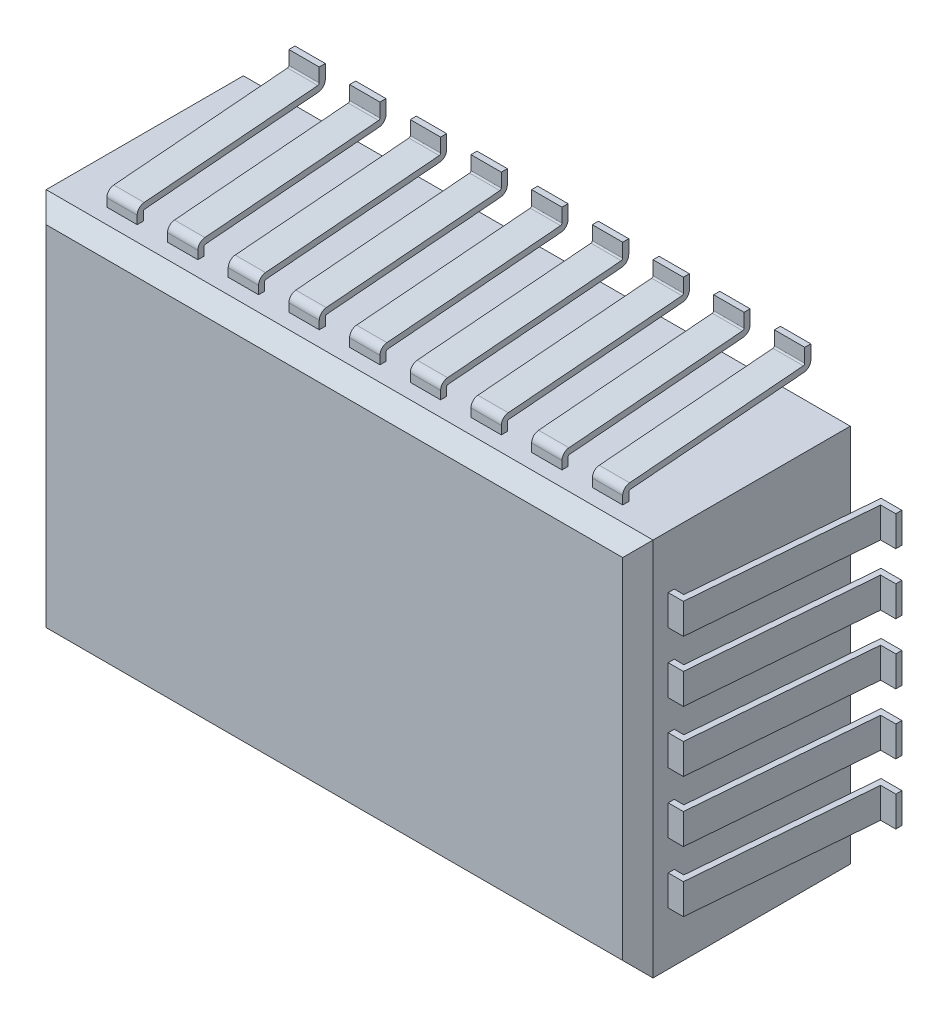
from build123d import *

# Parameters (mm, degrees)
COMPONENT_OUTLINE_W  = 4
COMPONENT_OUTLINE_H  = 2.5
EXTRUDE1_DEPTH       = 1.4
EXTRUDE_THIN1_DEPTH  = 0.1
LPATTERN1_COUNT      = 5
LPATTERN1_PITCH      = 0.4
LPATTERN1_COL_COUNT  = 5
LPATTERN1_COL_PITCH  = 0.4
MIRROR1_COPY_1_DEPTH = 0.1
MIRROR1_COPY_2_DEPTH = 0.1
MIRROR1_COPY_3_DEPTH = 0.1
MIRROR1_COPY_4_DEPTH = 0.1
MIRROR1_COPY_5_DEPTH = 0.1
MIRROR1_COPY_6_DEPTH = 0.1
MIRROR1_COPY_7_DEPTH = 0.1
MIRROR1_COPY_8_DEPTH = 0.1
EXTRUDE_THIN2_DEPTH  = 0.1
LPATTERN2_COUNT      = 3
LPATTERN2_PITCH      = 0.4
LPATTERN2_COL_COUNT  = 3
LPATTERN2_COL_PITCH  = 0.4
MIRROR2_COPY_1_DEPTH = 0.1
MIRROR2_COPY_2_DEPTH = 0.1
MIRROR2_COPY_3_DEPTH = 0.1
MIRROR2_COPY_4_DEPTH = 0.1
CHAMFER1_SIZE        = 0.1


with BuildPart() as part:
    # COMPONENT_OUTLINE → Extrude1 (new body)
    with BuildSketch(Plane.XY):
        Rectangle(COMPONENT_OUTLINE_W, COMPONENT_OUTLINE_H)
    extrude(amount=EXTRUDE1_DEPTH)

    # Sketch1 → Extrude-Thin1 (add, symmetric)
    with BuildSketch(Plane(origin=(0, 0, 0), x_dir=(0, 0, -1), z_dir=(1, 0, 0))):
        with BuildLine():
            Line((-1.2, 1.25), (-1.2, 1.303993356))
            ThreePointArc((-1.2, 1.303993356), (-1.186794114, 1.33784883), (-1.154152274, 1.353820644))
            Line((-1.154152274, 1.353820644), (-0.009169545, 1.449235871))
            ThreePointArc((-0.009169545, 1.449235871), (-0.002641177, 1.452430234), (0, 1.459201329))
            Line((0, 1.459201329), (0, 1.55))
            Line((0, 1.55), (0.04, 1.55))
            Line((0.04, 1.55), (0.04, 1.459201329))
            ThreePointArc((0.04, 1.459201329), (0.026794114, 1.425345854), (-0.005847726, 1.409374041))
            Line((-0.005847726, 1.409374041), (-1.150830455, 1.313958814))
            ThreePointArc((-1.150830455, 1.313958814), (-1.157358823, 1.310764451), (-1.16, 1.303993356))
            Line((-1.16, 1.303993356), (-1.16, 1.25))
            Line((-1.16, 1.25), (-1.2, 1.25))
        make_face()
    extrude_thin1 = extrude(amount=EXTRUDE_THIN1_DEPTH, both=True)

    # LPattern1: Extrude-Thin1 ×5
    with Locations(*[(-i * LPATTERN1_PITCH, 0, 0) for i in range(1, LPATTERN1_COUNT)]):
        add(extrude_thin1)

    # LPattern1 col: Extrude-Thin1 ×5
    with Locations(*[(i * LPATTERN1_COL_PITCH, 0, 0) for i in range(1, LPATTERN1_COL_COUNT)]):
        add(extrude_thin1)

    # Mirror1: Extrude-Thin1 across plane
    add(extrude_thin1.mirror(Plane.ZX))

    # Mirror1 copy 1 sketch → Mirror1 copy 1 (add, symmetric)
    with BuildSketch(Plane(origin=(-0.4, 0, 0), x_dir=(0, 0, -1), z_dir=(1, 0, 0))):
        with BuildLine():
            Line((-1.2, -1.25), (-1.2, -1.303993356))
            ThreePointArc((-1.2, -1.303993356), (-1.186794114, -1.33784883), (-1.154152274, -1.353820644))
            Line((-1.154152274, -1.353820644), (-0.009169545, -1.449235871))
            ThreePointArc((-0.009169545, -1.449235871), (-0.002641177, -1.452430234), (0, -1.459201329))
            Line((0, -1.459201329), (0, -1.55))
            Line((0, -1.55), (0.04, -1.55))
            Line((0.04, -1.55), (0.04, -1.459201329))
            ThreePointArc((0.04, -1.459201329), (0.026794114, -1.425345854), (-0.005847726, -1.409374041))
            Line((-0.005847726, -1.409374041), (-1.150830455, -1.313958814))
            ThreePointArc((-1.150830455, -1.313958814), (-1.157358823, -1.310764451), (-1.16, -1.303993356))
            Line((-1.16, -1.303993356), (-1.16, -1.25))
            Line((-1.16, -1.25), (-1.2, -1.25))
        make_face()
    extrude(amount=MIRROR1_COPY_1_DEPTH, both=True)

    # Mirror1 copy 2 sketch → Mirror1 copy 2 (add, symmetric)
    with BuildSketch(Plane(origin=(-0.8, 0, 0), x_dir=(0, 0, -1), z_dir=(1, 0, 0))):
        with BuildLine():
            Line((-1.2, -1.25), (-1.2, -1.303993356))
            ThreePointArc((-1.2, -1.303993356), (-1.186794114, -1.33784883), (-1.154152274, -1.353820644))
            Line((-1.154152274, -1.353820644), (-0.009169545, -1.449235871))
            ThreePointArc((-0.009169545, -1.449235871), (-0.002641177, -1.452430234), (0, -1.459201329))
            Line((0, -1.459201329), (0, -1.55))
            Line((0, -1.55), (0.04, -1.55))
            Line((0.04, -1.55), (0.04, -1.459201329))
            ThreePointArc((0.04, -1.459201329), (0.026794114, -1.425345854), (-0.005847726, -1.409374041))
            Line((-0.005847726, -1.409374041), (-1.150830455, -1.313958814))
            ThreePointArc((-1.150830455, -1.313958814), (-1.157358823, -1.310764451), (-1.16, -1.303993356))
            Line((-1.16, -1.303993356), (-1.16, -1.25))
            Line((-1.16, -1.25), (-1.2, -1.25))
        make_face()
    extrude(amount=MIRROR1_COPY_2_DEPTH, both=True)

    # Mirror1 copy 3 sketch → Mirror1 copy 3 (add, symmetric)
    with BuildSketch(Plane(origin=(-1.2, 0, 0), x_dir=(0, 0, -1), z_dir=(1, 0, 0))):
        with BuildLine():
            Line((-1.2, -1.25), (-1.2, -1.303993356))
            ThreePointArc((-1.2, -1.303993356), (-1.186794114, -1.33784883), (-1.154152274, -1.353820644))
            Line((-1.154152274, -1.353820644), (-0.009169545, -1.449235871))
            ThreePointArc((-0.009169545, -1.449235871), (-0.002641177, -1.452430234), (0, -1.459201329))
            Line((0, -1.459201329), (0, -1.55))
            Line((0, -1.55), (0.04, -1.55))
            Line((0.04, -1.55), (0.04, -1.459201329))
            ThreePointArc((0.04, -1.459201329), (0.026794114, -1.425345854), (-0.005847726, -1.409374041))
            Line((-0.005847726, -1.409374041), (-1.150830455, -1.313958814))
            ThreePointArc((-1.150830455, -1.313958814), (-1.157358823, -1.310764451), (-1.16, -1.303993356))
            Line((-1.16, -1.303993356), (-1.16, -1.25))
            Line((-1.16, -1.25), (-1.2, -1.25))
        make_face()
    extrude(amount=MIRROR1_COPY_3_DEPTH, both=True)

    # Mirror1 copy 4 sketch → Mirror1 copy 4 (add, symmetric)
    with BuildSketch(Plane(origin=(-1.6, 0, 0), x_dir=(0, 0, -1), z_dir=(1, 0, 0))):
        with BuildLine():
            Line((-1.2, -1.25), (-1.2, -1.303993356))
            ThreePointArc((-1.2, -1.303993356), (-1.186794114, -1.33784883), (-1.154152274, -1.353820644))
            Line((-1.154152274, -1.353820644), (-0.009169545, -1.449235871))
            ThreePointArc((-0.009169545, -1.449235871), (-0.002641177, -1.452430234), (0, -1.459201329))
            Line((0, -1.459201329), (0, -1.55))
            Line((0, -1.55), (0.04, -1.55))
            Line((0.04, -1.55), (0.04, -1.459201329))
            ThreePointArc((0.04, -1.459201329), (0.026794114, -1.425345854), (-0.005847726, -1.409374041))
            Line((-0.005847726, -1.409374041), (-1.150830455, -1.313958814))
            ThreePointArc((-1.150830455, -1.313958814), (-1.157358823, -1.310764451), (-1.16, -1.303993356))
            Line((-1.16, -1.303993356), (-1.16, -1.25))
            Line((-1.16, -1.25), (-1.2, -1.25))
        make_face()
    extrude(amount=MIRROR1_COPY_4_DEPTH, both=True)

    # Mirror1 copy 5 sketch → Mirror1 copy 5 (add, symmetric)
    with BuildSketch(Plane(origin=(0.4, 0, 0), x_dir=(0, 0, -1), z_dir=(1, 0, 0))):
        with BuildLine():
            Line((-1.2, -1.25), (-1.2, -1.303993356))
            ThreePointArc((-1.2, -1.303993356), (-1.186794114, -1.33784883), (-1.154152274, -1.353820644))
            Line((-1.154152274, -1.353820644), (-0.009169545, -1.449235871))
            ThreePointArc((-0.009169545, -1.449235871), (-0.002641177, -1.452430234), (0, -1.459201329))
            Line((0, -1.459201329), (0, -1.55))
            Line((0, -1.55), (0.04, -1.55))
            Line((0.04, -1.55), (0.04, -1.459201329))
            ThreePointArc((0.04, -1.459201329), (0.026794114, -1.425345854), (-0.005847726, -1.409374041))
            Line((-0.005847726, -1.409374041), (-1.150830455, -1.313958814))
            ThreePointArc((-1.150830455, -1.313958814), (-1.157358823, -1.310764451), (-1.16, -1.303993356))
            Line((-1.16, -1.303993356), (-1.16, -1.25))
            Line((-1.16, -1.25), (-1.2, -1.25))
        make_face()
    extrude(amount=MIRROR1_COPY_5_DEPTH, both=True)

    # Mirror1 copy 6 sketch → Mirror1 copy 6 (add, symmetric)
    with BuildSketch(Plane(origin=(0.8, 0, 0), x_dir=(0, 0, -1), z_dir=(1, 0, 0))):
        with BuildLine():
            Line((-1.2, -1.25), (-1.2, -1.303993356))
            ThreePointArc((-1.2, -1.303993356), (-1.186794114, -1.33784883), (-1.154152274, -1.353820644))
            Line((-1.154152274, -1.353820644), (-0.009169545, -1.449235871))
            ThreePointArc((-0.009169545, -1.449235871), (-0.002641177, -1.452430234), (0, -1.459201329))
            Line((0, -1.459201329), (0, -1.55))
            Line((0, -1.55), (0.04, -1.55))
            Line((0.04, -1.55), (0.04, -1.459201329))
            ThreePointArc((0.04, -1.459201329), (0.026794114, -1.425345854), (-0.005847726, -1.409374041))
            Line((-0.005847726, -1.409374041), (-1.150830455, -1.313958814))
            ThreePointArc((-1.150830455, -1.313958814), (-1.157358823, -1.310764451), (-1.16, -1.303993356))
            Line((-1.16, -1.303993356), (-1.16, -1.25))
            Line((-1.16, -1.25), (-1.2, -1.25))
        make_face()
    extrude(amount=MIRROR1_COPY_6_DEPTH, both=True)

    # Mirror1 copy 7 sketch → Mirror1 copy 7 (add, symmetric)
    with BuildSketch(Plane(origin=(1.2, 0, 0), x_dir=(0, 0, -1), z_dir=(1, 0, 0))):
        with BuildLine():
            Line((-1.2, -1.25), (-1.2, -1.303993356))
            ThreePointArc((-1.2, -1.303993356), (-1.186794114, -1.33784883), (-1.154152274, -1.353820644))
            Line((-1.154152274, -1.353820644), (-0.009169545, -1.449235871))
            ThreePointArc((-0.009169545, -1.449235871), (-0.002641177, -1.452430234), (0, -1.459201329))
            Line((0, -1.459201329), (0, -1.55))
            Line((0, -1.55), (0.04, -1.55))
            Line((0.04, -1.55), (0.04, -1.459201329))
            ThreePointArc((0.04, -1.459201329), (0.026794114, -1.425345854), (-0.005847726, -1.409374041))
            Line((-0.005847726, -1.409374041), (-1.150830455, -1.313958814))
            ThreePointArc((-1.150830455, -1.313958814), (-1.157358823, -1.310764451), (-1.16, -1.303993356))
            Line((-1.16, -1.303993356), (-1.16, -1.25))
            Line((-1.16, -1.25), (-1.2, -1.25))
        make_face()
    extrude(amount=MIRROR1_COPY_7_DEPTH, both=True)

    # Mirror1 copy 8 sketch → Mirror1 copy 8 (add, symmetric)
    with BuildSketch(Plane(origin=(1.6, 0, 0), x_dir=(0, 0, -1), z_dir=(1, 0, 0))):
        with BuildLine():
            Line((-1.2, -1.25), (-1.2, -1.303993356))
            ThreePointArc((-1.2, -1.303993356), (-1.186794114, -1.33784883), (-1.154152274, -1.353820644))
            Line((-1.154152274, -1.353820644), (-0.009169545, -1.449235871))
            ThreePointArc((-0.009169545, -1.449235871), (-0.002641177, -1.452430234), (0, -1.459201329))
            Line((0, -1.459201329), (0, -1.55))
            Line((0, -1.55), (0.04, -1.55))
            Line((0.04, -1.55), (0.04, -1.459201329))
            ThreePointArc((0.04, -1.459201329), (0.026794114, -1.425345854), (-0.005847726, -1.409374041))
            Line((-0.005847726, -1.409374041), (-1.150830455, -1.313958814))
            ThreePointArc((-1.150830455, -1.313958814), (-1.157358823, -1.310764451), (-1.16, -1.303993356))
            Line((-1.16, -1.303993356), (-1.16, -1.25))
            Line((-1.16, -1.25), (-1.2, -1.25))
        make_face()
    extrude(amount=MIRROR1_COPY_8_DEPTH, both=True)

    # Sketch2 → Extrude-Thin2 (add, symmetric)
    with BuildSketch(Plane(origin=(0, 0, 0), x_dir=(1, 0, 0), z_dir=(0, 1, 0))):
        Polygon((2, -1.2), (2.1, -1.2), (2.2, 0), (2.3, 0), (2.3, 0.04), (2.163194685, 0.04), (2.063194685, -1.16), (2, -1.16), align=None)
    extrude_thin2 = extrude(amount=EXTRUDE_THIN2_DEPTH, both=True)

    # LPattern2: Extrude-Thin2 ×3
    with Locations(*[(0, i * LPATTERN2_PITCH, 0) for i in range(1, LPATTERN2_COUNT)]):
        add(extrude_thin2)

    # LPattern2 col: Extrude-Thin2 ×3
    with Locations(*[(0, -i * LPATTERN2_COL_PITCH, 0) for i in range(1, LPATTERN2_COL_COUNT)]):
        add(extrude_thin2)

    # Mirror2: Extrude-Thin2 across plane
    add(extrude_thin2.mirror(Plane(origin=(0, 0, 0), x_dir=(0, 0, 1), z_dir=(1, 0, 0))))

    # Mirror2 copy 1 sketch → Mirror2 copy 1 (add, symmetric)
    with BuildSketch(Plane(origin=(0, 0.4, 0), x_dir=(-1, 0, 0), z_dir=(0, 1, 0))):
        Polygon((2, 1.2), (2.1, 1.2), (2.2, 0), (2.3, 0), (2.3, -0.04), (2.163194685, -0.04), (2.063194685, 1.16), (2, 1.16), align=None)
    extrude(amount=MIRROR2_COPY_1_DEPTH, both=True)

    # Mirror2 copy 2 sketch → Mirror2 copy 2 (add, symmetric)
    with BuildSketch(Plane(origin=(0, 0.8, 0), x_dir=(-1, 0, 0), z_dir=(0, 1, 0))):
        Polygon((2, 1.2), (2.1, 1.2), (2.2, 0), (2.3, 0), (2.3, -0.04), (2.163194685, -0.04), (2.063194685, 1.16), (2, 1.16), align=None)
    extrude(amount=MIRROR2_COPY_2_DEPTH, both=True)

    # Mirror2 copy 3 sketch → Mirror2 copy 3 (add, symmetric)
    with BuildSketch(Plane(origin=(0, -0.4, 0), x_dir=(-1, 0, 0), z_dir=(0, 1, 0))):
        Polygon((2, 1.2), (2.1, 1.2), (2.2, 0), (2.3, 0), (2.3, -0.04), (2.163194685, -0.04), (2.063194685, 1.16), (2, 1.16), align=None)
    extrude(amount=MIRROR2_COPY_3_DEPTH, both=True)

    # Mirror2 copy 4 sketch → Mirror2 copy 4 (add, symmetric)
    with BuildSketch(Plane(origin=(0, -0.8, 0), x_dir=(-1, 0, 0), z_dir=(0, 1, 0))):
        Polygon((2, 1.2), (2.1, 1.2), (2.2, 0), (2.3, 0), (2.3, -0.04), (2.163194685, -0.04), (2.063194685, 1.16), (2, 1.16), align=None)
    extrude(amount=MIRROR2_COPY_4_DEPTH, both=True)

    # Chamfer1
    chamfer1_edges = [part.edges().sort_by_distance(p)[0] for p in [
        (0, -1.25, 1.4),
        (2, 0, 1.4),
        (0, 1.25, 1.4),
        (-2, 0, 1.4),
    ]]
    chamfer(chamfer1_edges, length=CHAMFER1_SIZE)


solid = part.part
